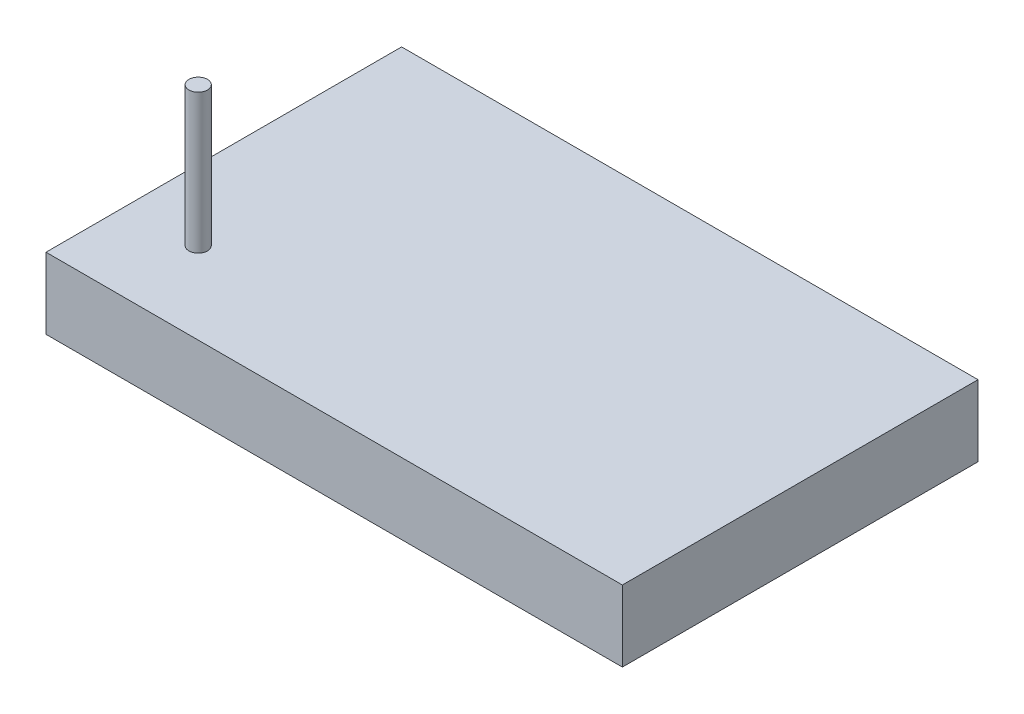
from build123d import *

# Parameters (mm, degrees)
SKETCH1_W           = 101.3
SKETCH1_H           = 62.5
BOSS_EXTRUDE1_DEPTH = 12.5
SKETCH2_R           = 1.625
BOSS_EXTRUDE2_DEPTH = 24.5


with BuildPart() as part:
    # Sketch1 → Boss-Extrude1 (new body)
    with BuildSketch(Plane(origin=(0, 0, 0), x_dir=(1, 0, 0), z_dir=(0, 1, 0))):
        with Locations((50.65, 31.25)):
            Rectangle(SKETCH1_W, SKETCH1_H)
    extrude(amount=BOSS_EXTRUDE1_DEPTH)

    # Sketch2 → Boss-Extrude2 (add)
    with BuildSketch(Plane(origin=(0, 12.5, 0), x_dir=(1, 0, 0), z_dir=(0, 1, 0))):
        with Locations(Location((12.375, 14.375, 0), (0, 0, 90))):
            Circle(SKETCH2_R)
    extrude(amount=BOSS_EXTRUDE2_DEPTH)


solid = part.part
